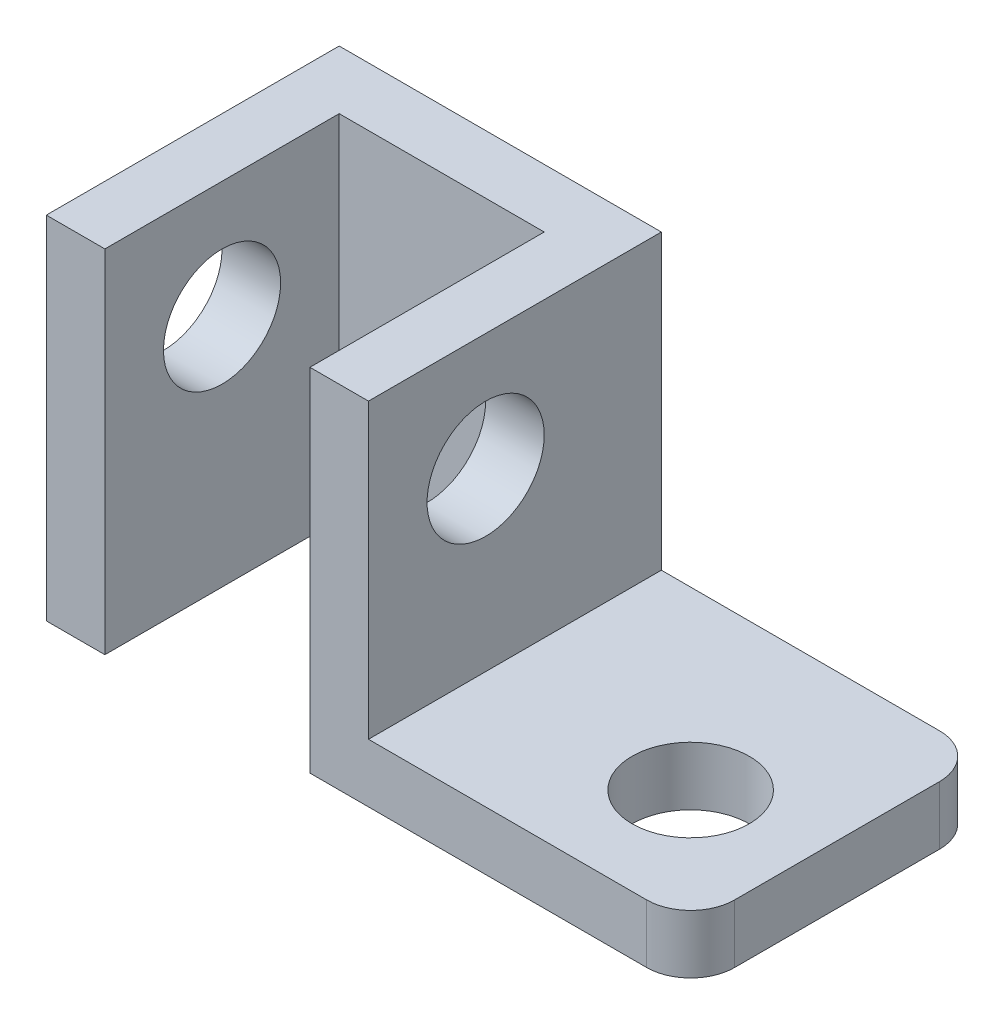
from build123d import *

# Parameters (mm, degrees)
EXTRUDE_1_DEPTH          = 508
CUT_EXTRUDE_1_DEPTH      = 3223.898695274
CUT_EXTRUDE_1_DEPTH_BACK = 3223.898695274
SKETCH_4_R               = 508
EXTRUDE_2_DEPTH          = 3048
CUT_EXTRUDE_2_DEPTH      = 4407.735299516
CUT_EXTRUDE_2_DEPTH_BACK = 4407.735299516
SKETCH_5_R               = 508


with BuildPart() as part:
    # 草图3 → 凸台-拉伸1 (new body)
    with BuildSketch(Plane(origin=(0, 0, 0), x_dir=(1, 0, 0), z_dir=(0, 1, 0))):
        with BuildLine():
            Line((0, 1524), (0, -1016))
            Line((0, -1016), (2413, -1016))
            ThreePointArc((2413, -1016), (2682.407683632, -904.407683632), (2794, -635))
            Line((2794, -635), (2794, 1143))
            ThreePointArc((2794, 1143), (2682.407683632, 1412.407683632), (2413, 1524))
            Line((2413, 1524), (0, 1524))
        make_face()
    extrude(amount=EXTRUDE_1_DEPTH)

    # 草图4 → 切除-拉伸1 (cut, two sides: drawn at the far end of the back side and taken through both)
    with BuildSketch(Plane(origin=(0, 0, 0), x_dir=(1, 0, 0), z_dir=(0, 1, 0)).offset(-CUT_EXTRUDE_1_DEPTH_BACK)):
        with Locations(Location((1778, 0, 0), (0, 0, 270))):
            Circle(SKETCH_4_R)
    extrude(amount=CUT_EXTRUDE_1_DEPTH + CUT_EXTRUDE_1_DEPTH_BACK, mode=Mode.SUBTRACT)

    # 草图1 → 凸台-拉伸2 (add)
    with BuildSketch(Plane(origin=(0, 0, 0), x_dir=(1, 0, 0), z_dir=(0, 1, 0))):
        Polygon((-508, -1016), (0, -1016), (0, 1524), (-2794, 1524), (-2794, -1016), (-2286, -1016), (-2286, 1016), (-508, 1016), align=None)
    extrude(amount=EXTRUDE_2_DEPTH)

    # 草图5 → 切除-拉伸2 (cut, two sides: drawn at the far end of the back side and taken through both)
    with BuildSketch(Plane(origin=(0, 0, 0), x_dir=(0, 0, -1), z_dir=(1, 0, 0)).offset(-CUT_EXTRUDE_2_DEPTH_BACK)):
        with Locations((0, 2032)):
            Circle(SKETCH_5_R)
    extrude(amount=CUT_EXTRUDE_2_DEPTH + CUT_EXTRUDE_2_DEPTH_BACK, mode=Mode.SUBTRACT)


solid = part.part
